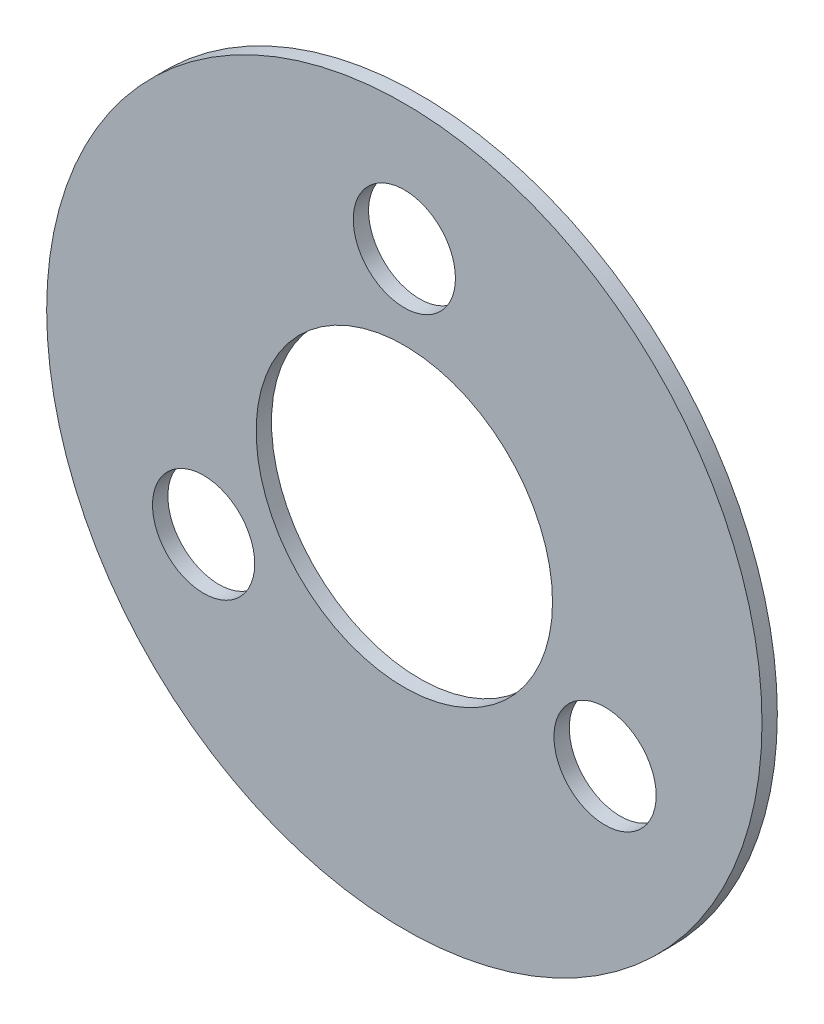
from build123d import *

# Parameters (mm, degrees)
SKETCH_1_R          = 70
SKETCH_1_R_2        = 29
EXTRUDE_1_DEPTH     = 3
SKETCH_2_R          = 10
CUT_EXTRUDE_1_DEPTH = 3


with BuildPart() as part:
    # 草图1 → 凸台-拉伸1 (new body)
    with BuildSketch(Plane.XY):
        Circle(SKETCH_1_R)
        Circle(SKETCH_1_R_2, mode=Mode.SUBTRACT)
    extrude(amount=EXTRUDE_1_DEPTH)

    # 草图2 → 切除-拉伸1 (cut)
    with BuildSketch(Plane.XY.offset(3)):
        with Locations((0, 45.357)):
            Circle(SKETCH_2_R)
        with Locations((39.280314239, -22.6785)):
            Circle(SKETCH_2_R)
        with Locations((-39.280314239, -22.6785)):
            Circle(SKETCH_2_R)
    extrude(amount=-CUT_EXTRUDE_1_DEPTH, mode=Mode.SUBTRACT)


solid = part.part
